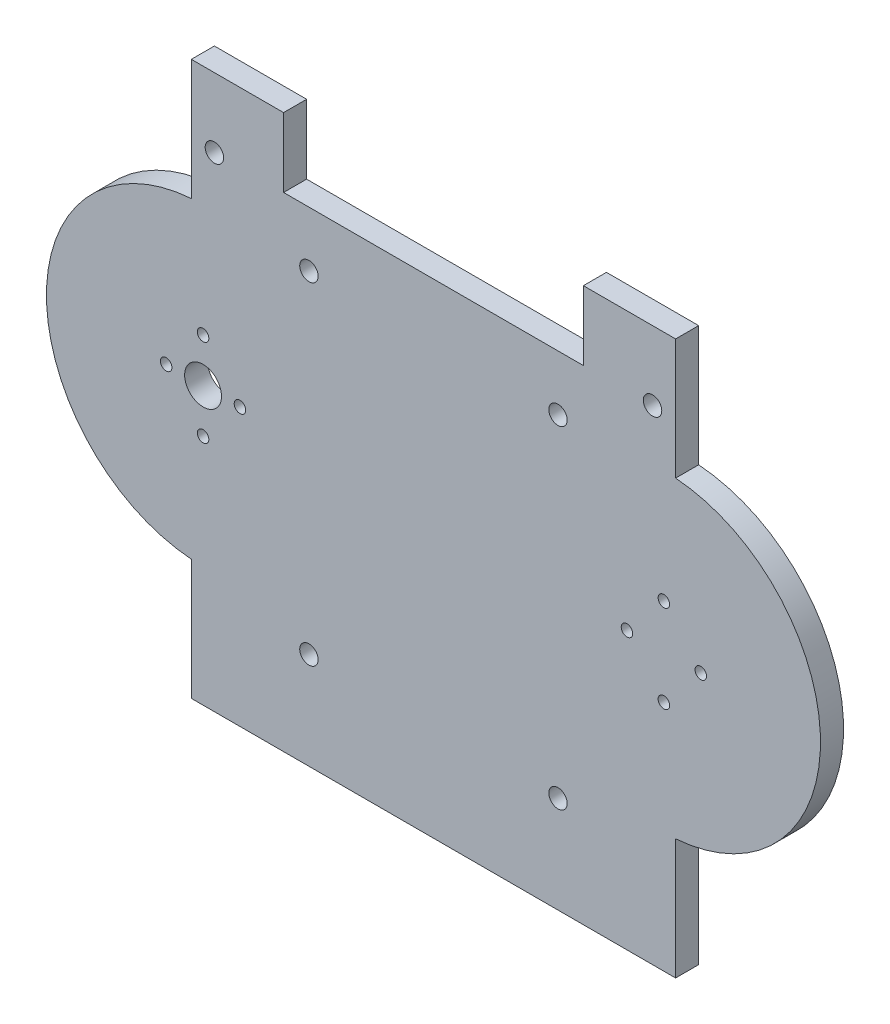
from build123d import *

# Parameters (mm, degrees)
SKETCH1_R           = 4
SKETCH1_R_2         = 2
SKETCH1_R_3         = 1.25
BOSS_EXTRUDE1_DEPTH = 5


with BuildPart() as part:
    # Sketch1 → Boss-Extrude1 (new body)
    with BuildSketch(Plane.XY):
        with BuildLine():
            Line((-32.5, 60), (-52.5, 60))
            Line((-52.5, 60), (-52.5, 33.860836522))
            ThreePointArc((-52.5, 33.860836522), (-83.9125, 0), (-52.5, -33.860836522))
            Line((-52.5, -33.860836522), (-52.5, -60))
            Line((-52.5, -60), (52.5, -60))
            Line((52.5, -60), (52.5, -33.860836522))
            ThreePointArc((52.5, -33.860836522), (83.9125, 0), (52.5, 33.860836522))
            Line((52.5, 33.860836522), (52.5, 60))
            Line((52.5, 60), (32.5, 60))
            Line((32.5, 60), (32.5, 45))
            Line((32.5, 45), (-32.5, 45))
            Line((-32.5, 45), (-32.5, 60))
        make_face()
        with Locations((-49.95625, 0)):
            Circle(SKETCH1_R, mode=Mode.SUBTRACT)
        with Locations((-27, -39)):
            Circle(SKETCH1_R_2, mode=Mode.SUBTRACT)
        with Locations((27, -39)):
            Circle(SKETCH1_R_2, mode=Mode.SUBTRACT)
        with Locations((-27, 33)):
            Circle(SKETCH1_R_2, mode=Mode.SUBTRACT)
        with Locations((-47.5, 45)):
            Circle(SKETCH1_R_2, mode=Mode.SUBTRACT)
        with Locations((27, 33)):
            Circle(SKETCH1_R_2, mode=Mode.SUBTRACT)
        with Locations((47.5, 45)):
            Circle(SKETCH1_R_2, mode=Mode.SUBTRACT)
        with Locations((-41.95625, 0)):
            Circle(SKETCH1_R_3, mode=Mode.SUBTRACT)
        with Locations((-49.95625, 9.5)):
            Circle(SKETCH1_R_3, mode=Mode.SUBTRACT)
        with Locations((-49.95625, -9.5)):
            Circle(SKETCH1_R_3, mode=Mode.SUBTRACT)
        with Locations((-57.95625, 0)):
            Circle(SKETCH1_R_3, mode=Mode.SUBTRACT)
        with Locations((49.95625, 9.5)):
            Circle(SKETCH1_R_3, mode=Mode.SUBTRACT)
        with Locations((49.95625, -9.5)):
            Circle(SKETCH1_R_3, mode=Mode.SUBTRACT)
        with Locations((41.95625, 0)):
            Circle(SKETCH1_R_3, mode=Mode.SUBTRACT)
        with Locations((57.95625, 0)):
            Circle(SKETCH1_R_3, mode=Mode.SUBTRACT)
    extrude(amount=BOSS_EXTRUDE1_DEPTH)


solid = part.part
